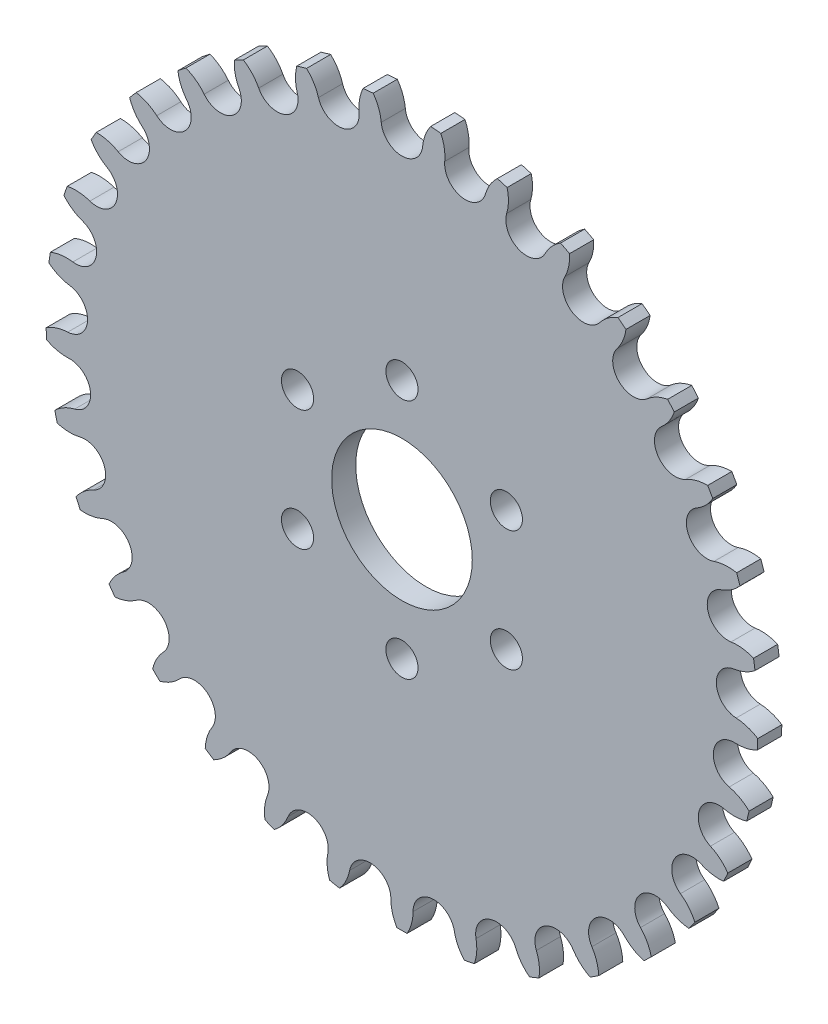
from build123d import *

# Parameters (mm, degrees)
EXTRUDE_1_DEPTH          = 6
PATTERN_CIRCULAR_1_COUNT = 33
SKETCH_3_R               = 17.5
SKETCH_3_R_2             = 4
CUT_EXTRUDE_1_DEPTH      = 126.384689292


with BuildPart() as part:
    # Эскиз2 → Бобышка-Вытянуть1 (new body)
    with BuildSketch(Plane.XY):
        with BuildLine():
            Line((0, 0), (0, 78.323370476))
            ThreePointArc((0, 78.323370476), (3.484380736, 79.670422408), (5.156544559, 83.010980172))
            ThreePointArc((5.156544559, 83.010980172), (5.803150448, 85.786940468), (7.16000398, 88.293532424))
            ThreePointArc((7.16000398, 88.293532424), (8.4203847, 88.182258116), (9.6790475, 88.052992932))
            ThreePointArc((9.6790475, 88.052992932), (10.537005274, 85.334912139), (10.646572212, 82.486746093))
            ThreePointArc((10.646572212, 82.486746093), (11.656313143, 78.890097476), (14.822795325, 76.907965137))
            Line((14.822795325, 76.907965137), (0, 0))
        make_face()
    extrude_1 = extrude(amount=EXTRUDE_1_DEPTH)

    # Круговой массив1: Бобышка-Вытянуть1 ×33 about axis
    pattern_circular_1_axis = Axis((0, 0, 0), (0, 0, 1))
    for i in range(1, PATTERN_CIRCULAR_1_COUNT):
        add(extrude_1.rotate(pattern_circular_1_axis, i * 360 / PATTERN_CIRCULAR_1_COUNT))

    # Эскиз3 → Вырез-Вытянуть1 (cut, through all)
    with BuildSketch(Plane.XY.offset(6)):
        Circle(SKETCH_3_R)
        with Locations((0, 30)):
            Circle(SKETCH_3_R_2)
        with Locations((25.980762114, 15)):
            Circle(SKETCH_3_R_2)
        with Locations((25.980762114, -15)):
            Circle(SKETCH_3_R_2)
        with Locations((0, -30)):
            Circle(SKETCH_3_R_2)
        with Locations((-25.980762114, -15)):
            Circle(SKETCH_3_R_2)
        with Locations((-25.980762114, 15)):
            Circle(SKETCH_3_R_2)
    extrude(amount=-CUT_EXTRUDE_1_DEPTH, mode=Mode.SUBTRACT)


solid = part.part
